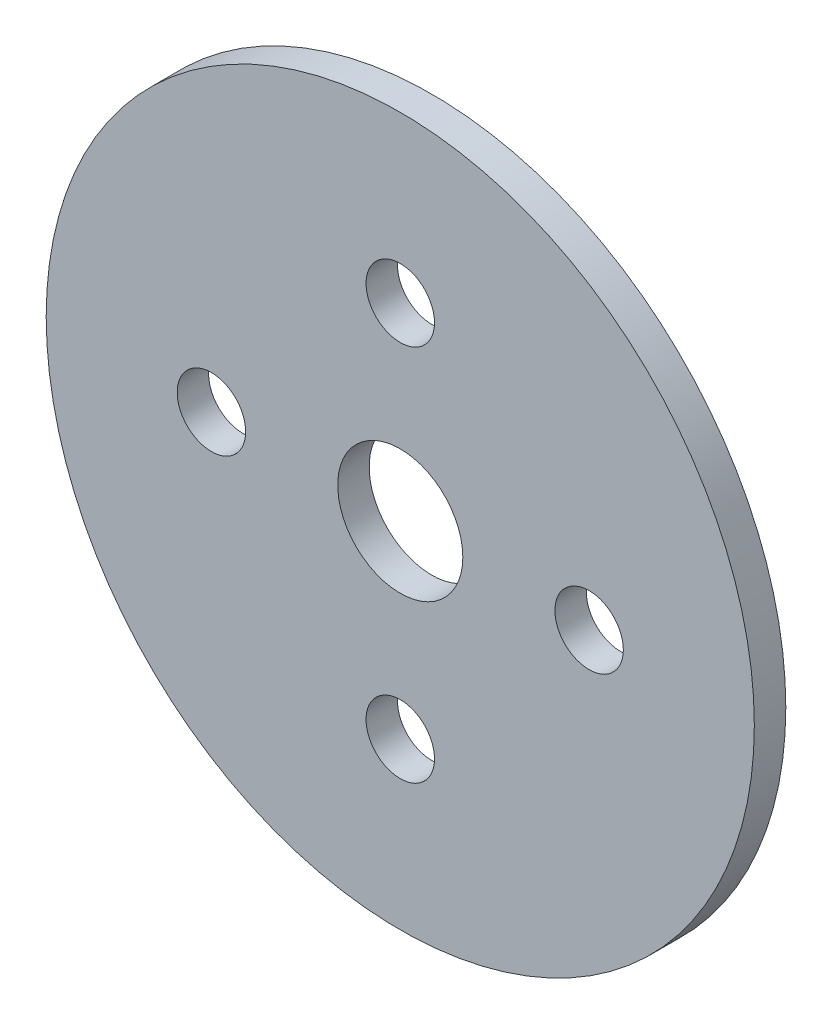
from build123d import *

# Parameters (mm, degrees)
SKETCH1_R           = 22.5
SKETCH1_R_2         = 2.175
SKETCH1_R_3         = 3.975
BOSS_EXTRUDE1_DEPTH = 2


with BuildPart() as part:
    # Sketch1 → Boss-Extrude1 (new body)
    with BuildSketch(Plane.XY):
        Circle(SKETCH1_R)
        with Locations((12, 0)):
            Circle(SKETCH1_R_2, mode=Mode.SUBTRACT)
        with Locations((0, 12)):
            Circle(SKETCH1_R_2, mode=Mode.SUBTRACT)
        with Locations((-12, 0)):
            Circle(SKETCH1_R_2, mode=Mode.SUBTRACT)
        with Locations((0, -12)):
            Circle(SKETCH1_R_2, mode=Mode.SUBTRACT)
        Circle(SKETCH1_R_3, mode=Mode.SUBTRACT)
    extrude(amount=BOSS_EXTRUDE1_DEPTH)


solid = part.part
